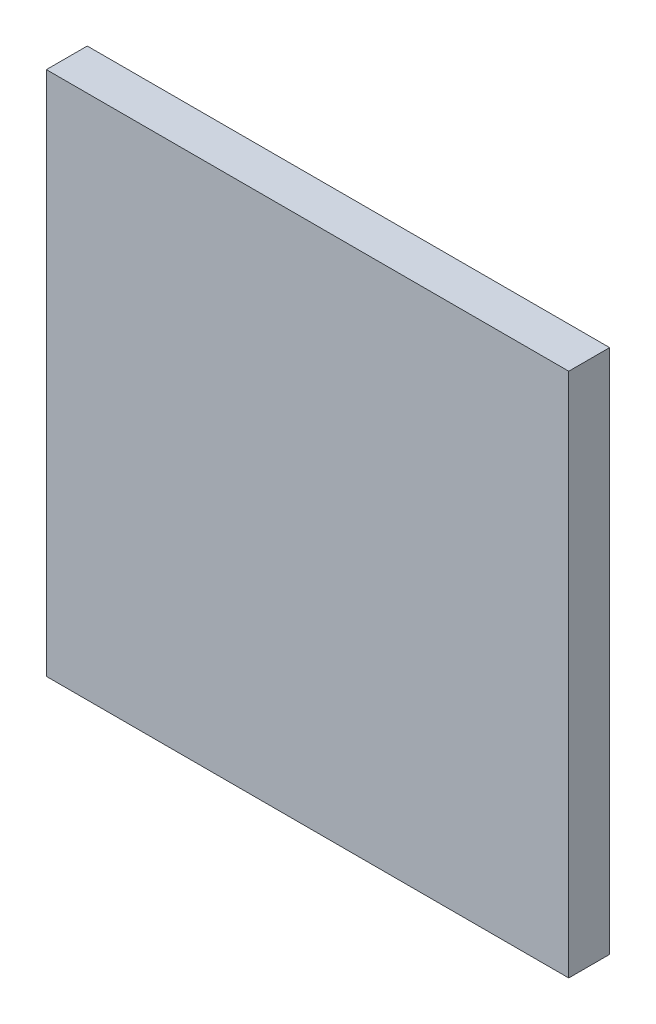
from build123d import *

# Parameters (mm, degrees)
SKETCH1_W               = 12.7762
SKETCH1_H               = 12.8524
COMPONENT_OUTLINE_DEPTH = 1


with BuildPart() as part:
    # Sketch1 → Component_Outline (new body)
    with BuildSketch(Plane.XY):
        with Locations((-0.0381, 0)):
            Rectangle(SKETCH1_W, SKETCH1_H)
    extrude(amount=COMPONENT_OUTLINE_DEPTH)


solid = part.part
